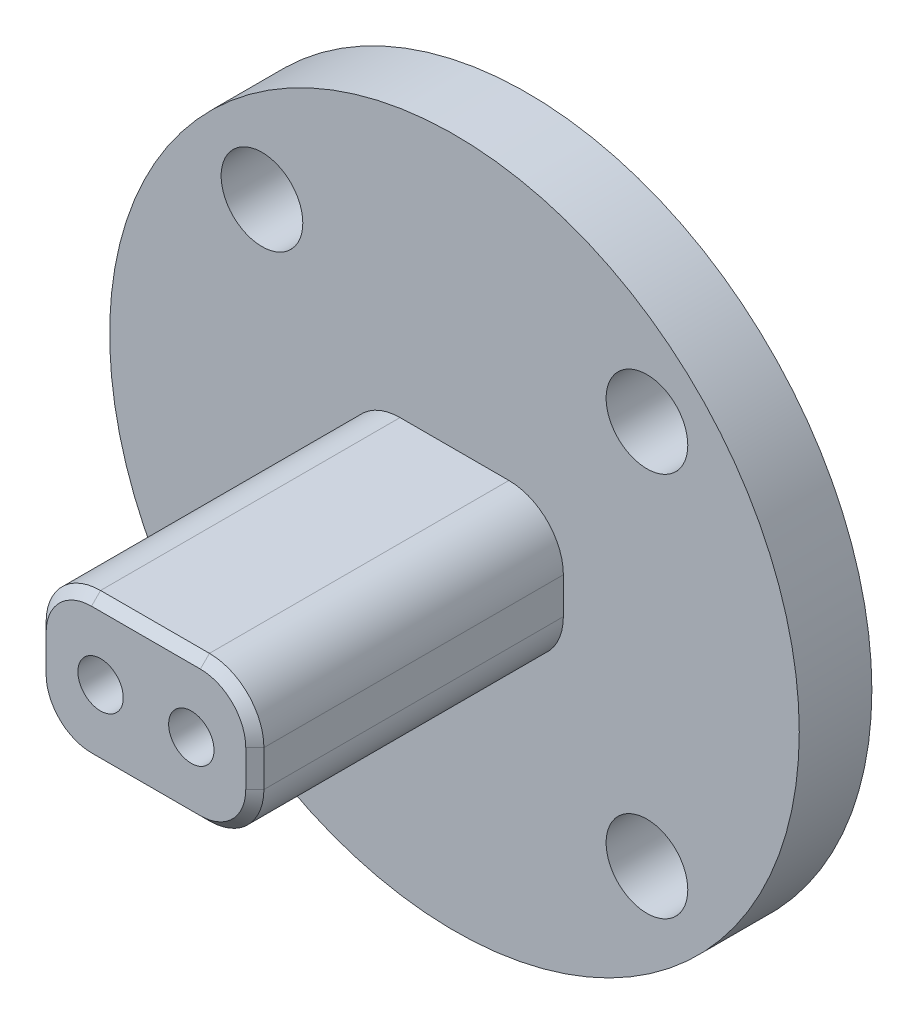
from build123d import *

# Parameters (mm, degrees)
SKETCH1_R                 = 19
BOSS_EXTRUDE1_DEPTH       = 4
M4_CLEARANCE_HOLE1_D      = 4.5
BOSS_EXTRUDE2_DEPTH       = 17
CHAMFER1_SIZE             = 0.5
M3X0_5_TAPPED_HOLE1_D     = 2.5
M3X0_5_TAPPED_HOLE1_DEPTH = 7.5
M3X0_5_TAPPED_HOLE1_TIP   = 0.751075774


with BuildPart() as part:
    # Sketch1 → Boss-Extrude1 (new body)
    with BuildSketch(Plane.XY):
        Circle(SKETCH1_R)
    extrude(amount=BOSS_EXTRUDE1_DEPTH)

    # M4 Clearance Hole1 (through all)
    with Locations(Plane.XY.offset(4)):
        with Locations((10.606601718, 10.606601718), (-10.606601718, -10.606601718), (-10.606601718, 10.606601718), (10.606601718, -10.606601718)):
            Hole(M4_CLEARANCE_HOLE1_D / 2)

    # Sketch4 → Boss-Extrude2 (add)
    with BuildSketch(Plane.XY.offset(4)):
        with BuildLine():
            Line((-3, -4), (3, -4))
            ThreePointArc((3, -4), (5.121320344, -3.121320344), (6, -1))
            Line((6, -1), (6, 1))
            ThreePointArc((6, 1), (5.121320344, 3.121320344), (3, 4))
            Line((3, 4), (-3, 4))
            ThreePointArc((-3, 4), (-5.121320344, 3.121320344), (-6, 1))
            Line((-6, 1), (-6, -1))
            ThreePointArc((-6, -1), (-5.121320344, -3.121320344), (-3, -4))
        make_face()
    extrude(amount=BOSS_EXTRUDE2_DEPTH)

    # Chamfer1
    chamfer1_edges = [part.edges().sort_by_distance(p)[0] for p in [
        (5.121320344, 3.121320344, 21),
        (0, 4, 21),
        (-5.121320344, 3.121320344, 21),
        (-6, 0, 21),
        (-5.121320344, -3.121320344, 21),
        (0, -4, 21),
        (5.121320344, -3.121320344, 21),
        (6, 0, 21),
    ]]
    chamfer(chamfer1_edges, length=CHAMFER1_SIZE)

    # M3x0.5 Tapped Hole1
    with Locations(Plane.XY.offset(21)):
        with Locations((-2.5, 0), (2.5, 0)):
            Hole(M3X0_5_TAPPED_HOLE1_D / 2, depth=M3X0_5_TAPPED_HOLE1_DEPTH)
            with Locations((0, 0, -(M3X0_5_TAPPED_HOLE1_DEPTH + M3X0_5_TAPPED_HOLE1_TIP / 2))):  # 118° drill point
                Cone(0, M3X0_5_TAPPED_HOLE1_D / 2, M3X0_5_TAPPED_HOLE1_TIP, mode=Mode.SUBTRACT)


solid = part.part
